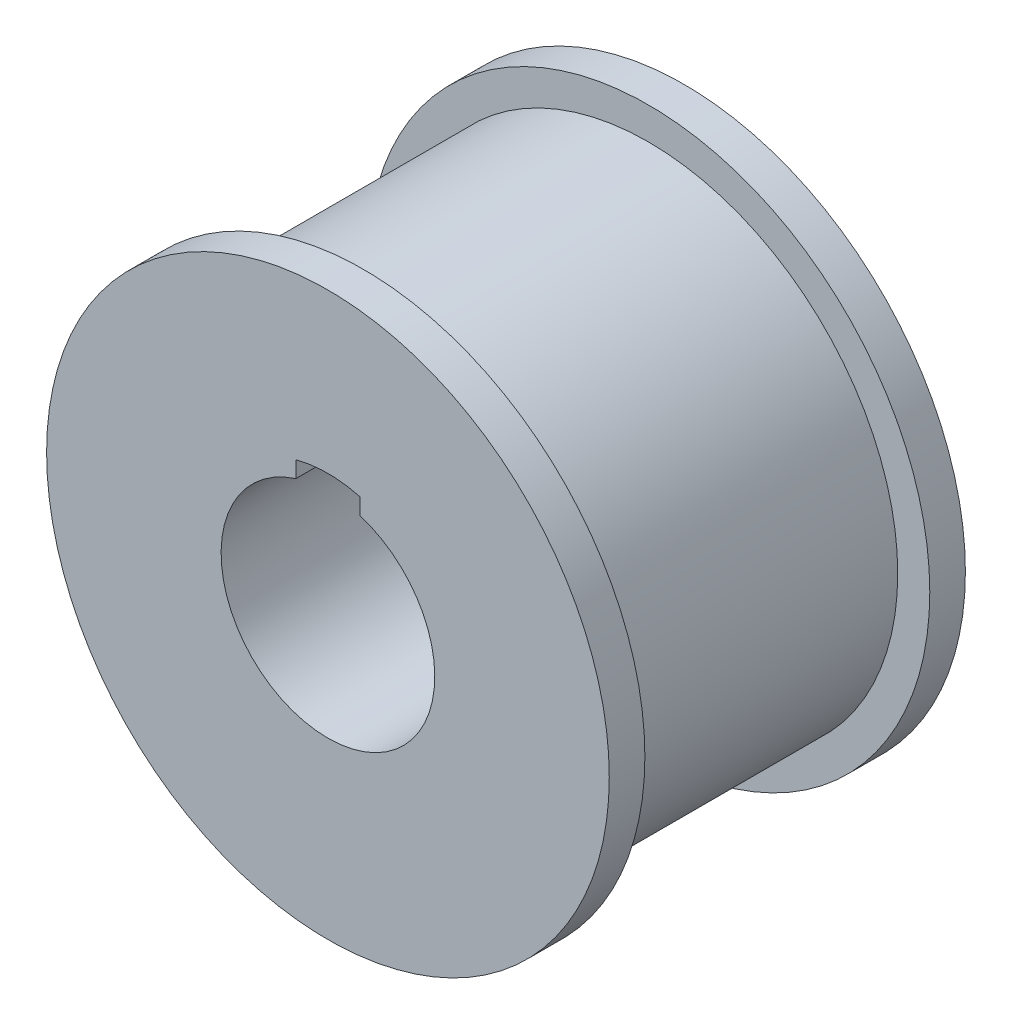
from build123d import *

# Parameters (mm, degrees)
SKETCH1_R           = 70
SKETCH1_R_2         = 30
BOSS_EXTRUDE1_DEPTH = 40
SKETCH2_R           = 79
SKETCH2_R_2         = 30
BOSS_EXTRUDE2_DEPTH = 10
CUT_EXTRUDE1_DEPTH  = 150.939987995


with BuildPart() as part:
    # Sketch1 → Boss-Extrude1 (new, symmetric)
    with BuildSketch(Plane.XY):
        Circle(SKETCH1_R)
        Circle(SKETCH1_R_2, mode=Mode.SUBTRACT)
    extrude(amount=BOSS_EXTRUDE1_DEPTH, both=True)

    # Sketch2 → Boss-Extrude2 (add)
    with BuildSketch(Plane.XY.offset(40)):
        Circle(SKETCH2_R)
        Circle(SKETCH2_R_2, mode=Mode.SUBTRACT)
    boss_extrude2 = extrude(amount=BOSS_EXTRUDE2_DEPTH)

    # Mirror1: Boss-Extrude2 across plane
    add(boss_extrude2.mirror(Plane.XY))

    # Sketch3 → Cut-Extrude1 (cut, through all)
    with BuildSketch(Plane.XY.offset(50)):
        with BuildLine():
            Line((9, 16.370254424), (9, 33.20180718))
            ThreePointArc((9, 33.20180718), (0, 34.4), (-9, 33.20180718))
            Line((-9, 33.20180718), (-9, 16.370254424))
            Line((-9, 16.370254424), (9, 16.370254424))
        make_face()
    extrude(amount=-CUT_EXTRUDE1_DEPTH, mode=Mode.SUBTRACT)


solid = part.part
